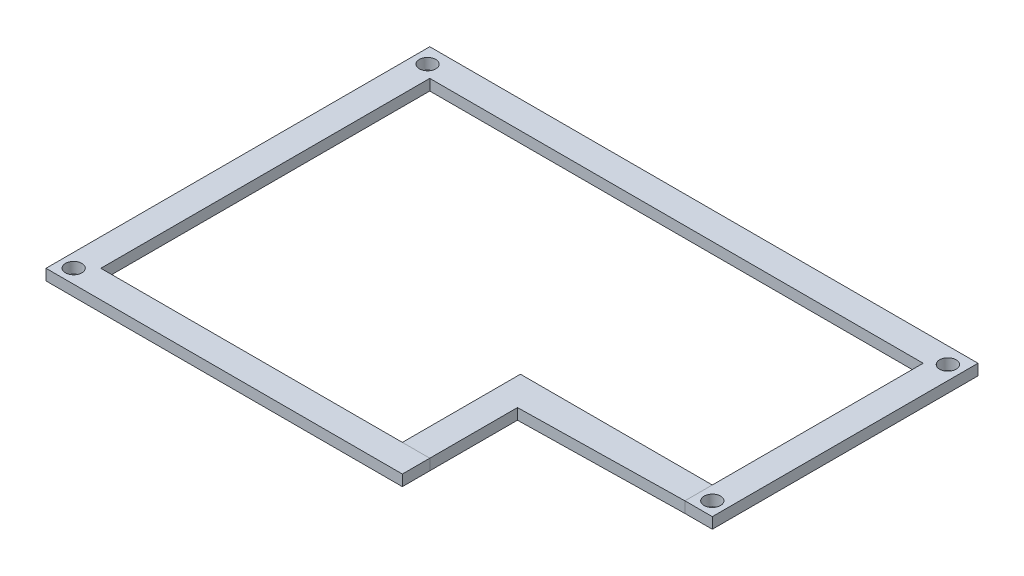
from build123d import *

# Parameters (mm, degrees)
SKETCH1_W           = 100
SKETCH1_H           = 70
SKETCH1_W_2         = 90
SKETCH1_H_2         = 60
BOSS_EXTRUDE1_DEPTH = 2
SKETCH2_W           = 35
SKETCH2_H           = 21.54
CUT_EXTRUDE1_DEPTH  = 2
BOSS_EXTRUDE2_DEPTH = 2
SKETCH4_R           = 1.5
CUT_EXTRUDE2_DEPTH  = 2


with BuildPart() as part:
    # Sketch1 → Boss-Extrude1 (new body)
    with BuildSketch(Plane(origin=(0, 0, 0), x_dir=(1, 0, 0), z_dir=(0, 1, 0))):
        Rectangle(SKETCH1_W, SKETCH1_H)
        Rectangle(SKETCH1_W_2, SKETCH1_H_2, mode=Mode.SUBTRACT)
    extrude(amount=BOSS_EXTRUDE1_DEPTH)

    # Sketch2 → Cut-Extrude1 (cut)
    with BuildSketch(Plane(origin=(0, 2, 0), x_dir=(1, 0, 0), z_dir=(0, 1, 0))):
        with Locations((32.5, -24.23)):
            Rectangle(SKETCH2_W, SKETCH2_H)
    extrude(amount=-CUT_EXTRUDE1_DEPTH, mode=Mode.SUBTRACT)

    # Sketch4 → Cut-Extrude2 (cut)
    with BuildSketch(Plane(origin=(0, 2, 0), x_dir=(1, 0, 0), z_dir=(0, 1, 0))):
        with Locations(Location((-47.45, 32.05, 0), (0, 0, 270))):
            Circle(SKETCH4_R)
        with Locations(Location((47.45, 32.05, 0), (0, 0, 270))):
            Circle(SKETCH4_R)
        with Locations(Location((47.5, -10.96, 0), (0, 0, 270))):
            Circle(SKETCH4_R)
        with Locations(Location((-47.5, -32.45, 0), (0, 0, 270))):
            Circle(SKETCH4_R)
    extrude(amount=-CUT_EXTRUDE2_DEPTH, mode=Mode.SUBTRACT)


with BuildPart() as body_2:
    # Sketch3 → Boss-Extrude2 (new body)
    with BuildSketch(Plane(origin=(0, 2, 0), x_dir=(1, 0, 0), z_dir=(0, 1, 0))):
        Polygon((15, -30), (15, -14), (45, -13.46), (45, -8.46), (10, -8.46), (10, -30), align=None)
    extrude(amount=-BOSS_EXTRUDE2_DEPTH)


solid = Compound([part.part, body_2.part])
